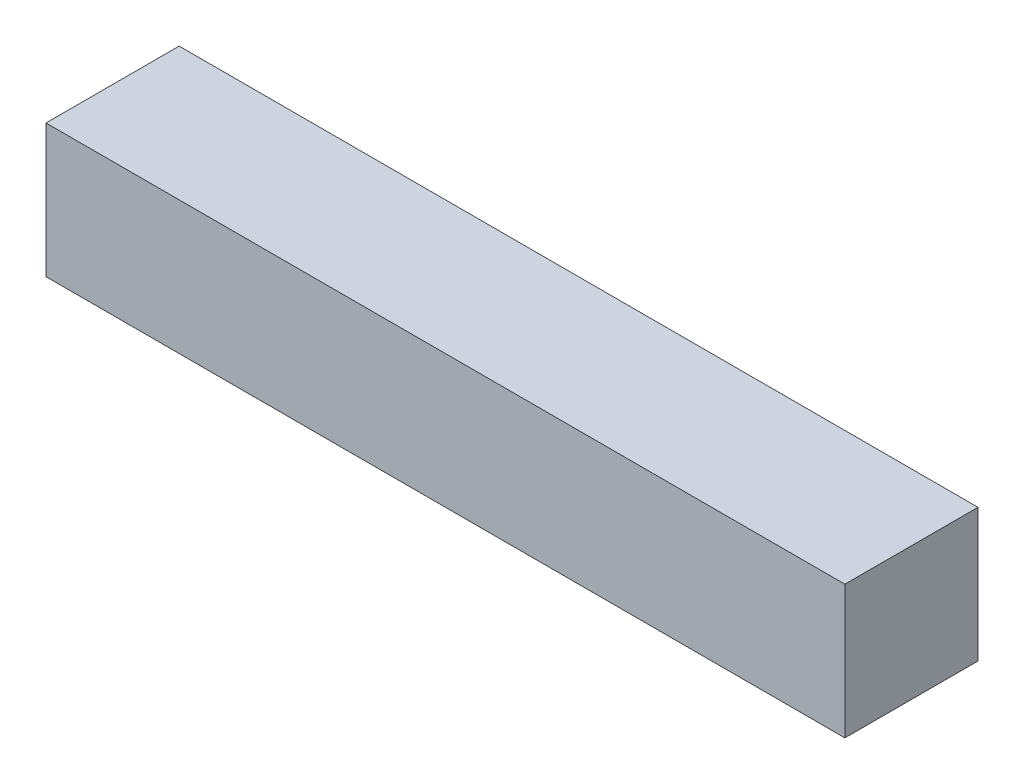
from build123d import *

# Parameters (mm, degrees)
ESQUISSE1_W        = 30
ESQUISSE1_H        = 5
BOSS_EXTRU_1_DEPTH = 5


with BuildPart() as part:
    # Esquisse1 → Boss.-Extru.1 (new body)
    with BuildSketch(Plane.XY):
        Rectangle(ESQUISSE1_W, ESQUISSE1_H)
    extrude(amount=BOSS_EXTRU_1_DEPTH)


solid = part.part
